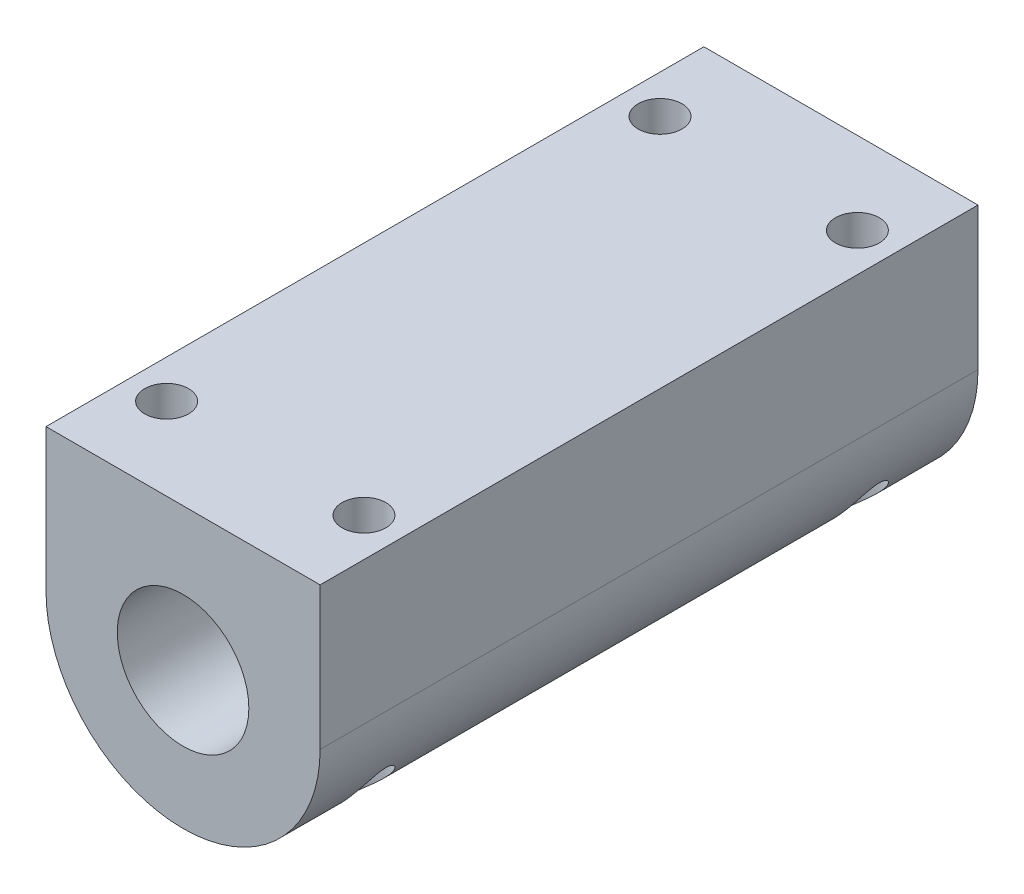
from build123d import *

# Parameters (mm, degrees)
ESBO_O1_R                = 6
RESSALTO_EXTRUS_O1_DEPTH = 60
ESBO_O3_R                = 2
CORTE_EXTRUS_O1_DEPTH    = 67.381473319


with BuildPart() as part:
    # Esboço1 → Ressalto-extrusão1 (new body)
    with BuildSketch(Plane.XY):
        with BuildLine():
            Line((-12.5, 0), (-12.5, 13))
            Line((-12.5, 13), (12.5, 13))
            Line((12.5, 13), (12.5, 0))
            ThreePointArc((12.5, 0), (0, -12.5), (-12.5, 0))
        make_face()
        Circle(ESBO_O1_R, mode=Mode.SUBTRACT)
    extrude(amount=RESSALTO_EXTRUS_O1_DEPTH)

    # Esboço3 → Corte-extrusão1 (cut, through all)
    with BuildSketch(Plane(origin=(0, 13, 0), x_dir=(1, 0, 0), z_dir=(0, 1, 0))):
        with Locations(Location((-9, -52.5, 0), (0, 0, 270))):
            Circle(ESBO_O3_R)
        with Locations(Location((-9, -7.5, 0), (0, 0, 270))):
            Circle(ESBO_O3_R)
        with Locations(Location((9, -52.5, 0), (0, 0, 270))):
            Circle(ESBO_O3_R)
        with Locations(Location((9, -7.5, 0), (0, 0, 270))):
            Circle(ESBO_O3_R)
    extrude(amount=-CORTE_EXTRUS_O1_DEPTH, mode=Mode.SUBTRACT)


solid = part.part
